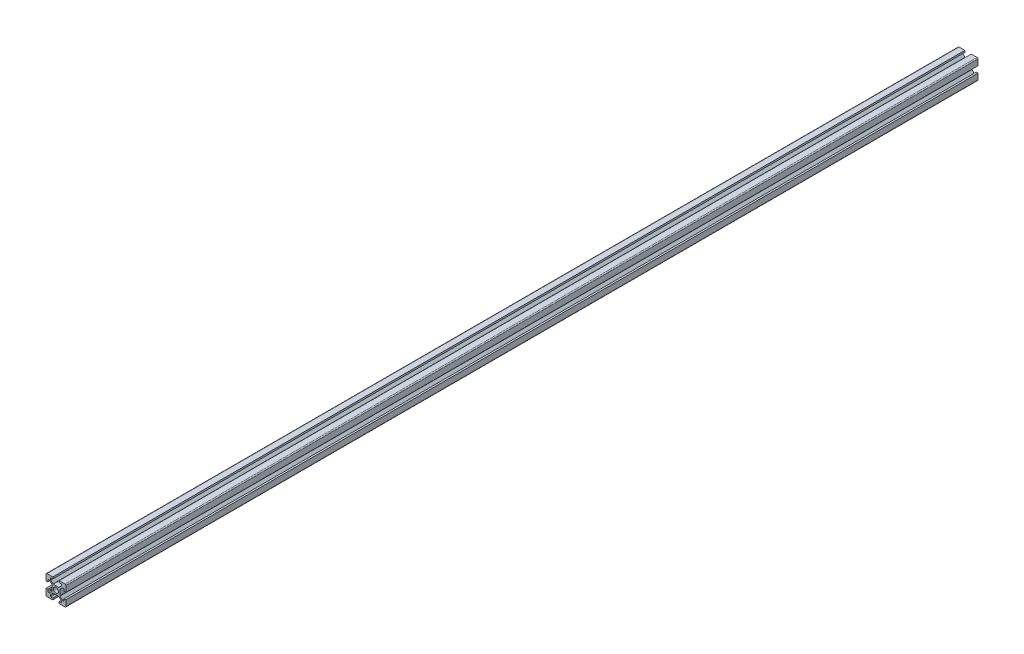
from build123d import *

# Parameters (mm, degrees)
SKETCH1_R           = 2.5
BOSS_EXTRUDE1_DEPTH = 914.4
FILLET1_R           = 1
FILLET2_R           = 0.5
FILLET3_R           = 0.5
FILLET4_R           = 0.5
FILLET5_R           = 0.5


with BuildPart() as part:
    # Sketch1 → Boss-Extrude1 (new body)
    with BuildSketch(Plane.XY):
        Polygon((13.2, 0), (13.2, 1.8), (15.45, 1.8), (15.45, 3.6), (12.95, 6.1), (7.05, 6.1), (4.55, 3.6), (4.55, 1.8), (6.8, 1.8), (6.8, 0), (0, 0), (0, 6.8), (1.8, 6.8), (1.8, 4.55), (3.6, 4.55), (6.1, 7.05), (6.1, 12.95), (3.6, 15.45), (1.8, 15.45), (1.8, 13.2), (0, 13.2), (0, 20), (6.8, 20), (6.8, 18.2), (4.55, 18.2), (4.55, 16.4), (7.05, 13.9), (12.95, 13.9), (15.45, 16.4), (15.45, 18.2), (13.2, 18.2), (13.2, 20), (20, 20), (20, 13.2), (18.2, 13.2), (18.2, 15.45), (16.4, 15.45), (13.9, 12.95), (13.9, 7.05), (16.4, 4.55), (18.2, 4.55), (18.2, 6.8), (20, 6.8), (20, 0), align=None)
        with Locations((10, 10)):
            Circle(SKETCH1_R, mode=Mode.SUBTRACT)
    extrude(amount=BOSS_EXTRUDE1_DEPTH)

    # Fillet1
    fillet1_edges = [part.edges().sort_by_distance(p)[0] for p in [
        (0, 0, 457.2),
        (0, 20, 457.2),
        (20, 20, 457.2),
        (20, 0, 457.2),
    ]]
    fillet(fillet1_edges, radius=FILLET1_R)

    # Fillet2
    fillet2_edges = [part.edges().sort_by_distance(p)[0] for p in [
        (4.55, 18.2, 457.2),
        (4.55, 16.4, 457.2),
        (7.05, 13.9, 457.2),
        (12.95, 13.9, 457.2),
        (15.45, 16.4, 457.2),
        (15.45, 18.2, 457.2),
    ]]
    fillet(fillet2_edges, radius=FILLET2_R)

    # Fillet3
    fillet3_edges = [part.edges().sort_by_distance(p)[0] for p in [
        (18.2, 15.45, 457.2),
        (16.4, 15.45, 457.2),
        (13.9, 12.95, 457.2),
        (13.9, 7.05, 457.2),
        (16.4, 4.55, 457.2),
        (18.2, 4.55, 457.2),
    ]]
    fillet(fillet3_edges, radius=FILLET3_R)

    # Fillet4
    fillet4_edges = [part.edges().sort_by_distance(p)[0] for p in [
        (1.8, 4.55, 457.2),
        (3.6, 4.55, 457.2),
        (6.1, 7.05, 457.2),
        (6.1, 12.95, 457.2),
        (3.6, 15.45, 457.2),
        (1.8, 15.45, 457.2),
    ]]
    fillet(fillet4_edges, radius=FILLET4_R)

    # Fillet5
    fillet5_edges = [part.edges().sort_by_distance(p)[0] for p in [
        (15.45, 1.8, 457.2),
        (15.45, 3.6, 457.2),
        (12.95, 6.1, 457.2),
        (7.05, 6.1, 457.2),
        (4.55, 3.6, 457.2),
        (4.55, 1.8, 457.2),
    ]]
    fillet(fillet5_edges, radius=FILLET5_R)


solid = part.part
